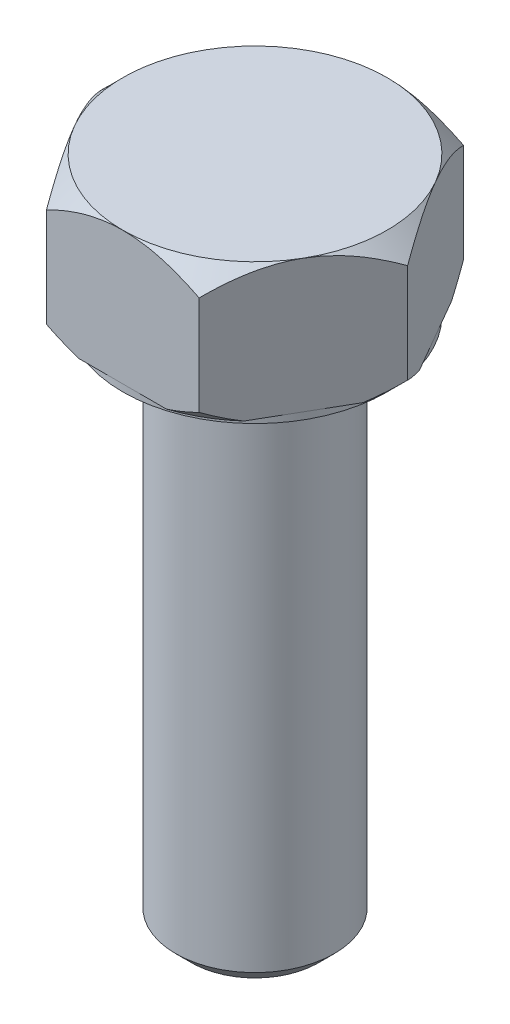
from build123d import *

# Parameters (mm, degrees)
BOSS_EXTRUDE1_DEPTH = 5.3
SKETCH2_OUTSIDE_W   = 16.782
SKETCH2_OUTSIDE_H   = 15.234
SKETCH2_OUTSIDE_R   = 5
CUT_EXTRUDE1_DEPTH  = 0.265
SKETCH3_R           = 3
BOSS_EXTRUDE2_DEPTH = 20
CHAMFER1_SIZE       = 0.6


with BuildPart() as part:
    # Sketch1 → Boss-Extrude1 (new body)
    with BuildSketch(Plane(origin=(0, 0, 0), x_dir=(1, 0, 0), z_dir=(0, 1, 0))):
        Polygon((5.773502692, 0), (2.886751346, 5), (-2.886751346, 5), (-5.773502692, 0), (-2.886751346, -5), (2.886751346, -5), align=None)
    extrude(amount=-BOSS_EXTRUDE1_DEPTH)

    # Sketch4 → Cut-Revolve1 (revolve, cut)
    with BuildSketch(Plane(origin=(0, 0, 0), x_dir=(0, 0, -1), z_dir=(1, 0, 0))):
        Polygon((-5, 0), (-6.65, 0), (-6.65, -1.65), align=None)
        Polygon((-6.65, -3.65), (-5, -5.3), (-6.65, -5.3), align=None)
    revolve(axis=Axis((0, 0, 0), (0, -1, 0)), mode=Mode.SUBTRACT)

    # Sketch2 outside → Cut-Extrude1 (cut)
    with BuildSketch(Plane.XZ.offset(5.3)):
        Rectangle(SKETCH2_OUTSIDE_W, SKETCH2_OUTSIDE_H)
        with Locations(Location((0, 0, 0), (0, 0, 90))):
            Circle(SKETCH2_OUTSIDE_R, mode=Mode.SUBTRACT)
    extrude(amount=-CUT_EXTRUDE1_DEPTH, mode=Mode.SUBTRACT)

    # Sketch3 → Boss-Extrude2 (add)
    with BuildSketch(Plane.XZ.offset(5.3)):
        with Locations(Location((0, 0, 0), (0, 0, 90))):
            Circle(SKETCH3_R)
    extrude(amount=BOSS_EXTRUDE2_DEPTH)

    # Chamfer1
    chamfer1_edges = [part.edges().sort_by_distance(p)[0] for p in [
        (0, -25.3, -3),
    ]]
    chamfer(chamfer1_edges, length=CHAMFER1_SIZE)


solid = part.part
